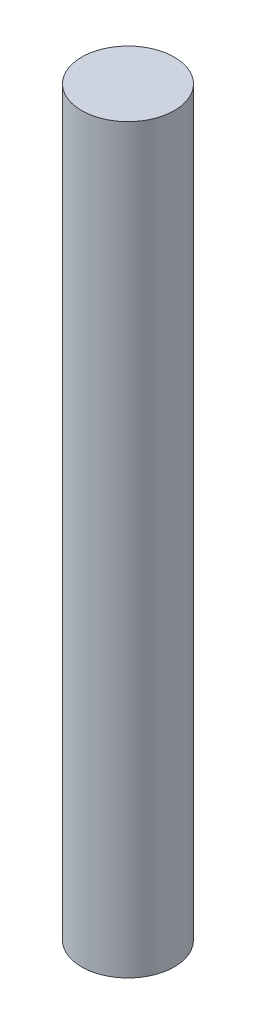
from build123d import *

# Parameters (mm, degrees)
SKETCH1_R           = 6.35
BOSS_EXTRUDE1_DEPTH = 101.6


with BuildPart() as part:
    # Sketch1 → Boss-Extrude1 (new body)
    with BuildSketch(Plane(origin=(0, 0, 0), x_dir=(1, 0, 0), z_dir=(0, 1, 0))):
        with Locations(Location((0, 0, 0), (0, 0, 270))):
            Circle(SKETCH1_R)
    extrude(amount=BOSS_EXTRUDE1_DEPTH)


solid = part.part
